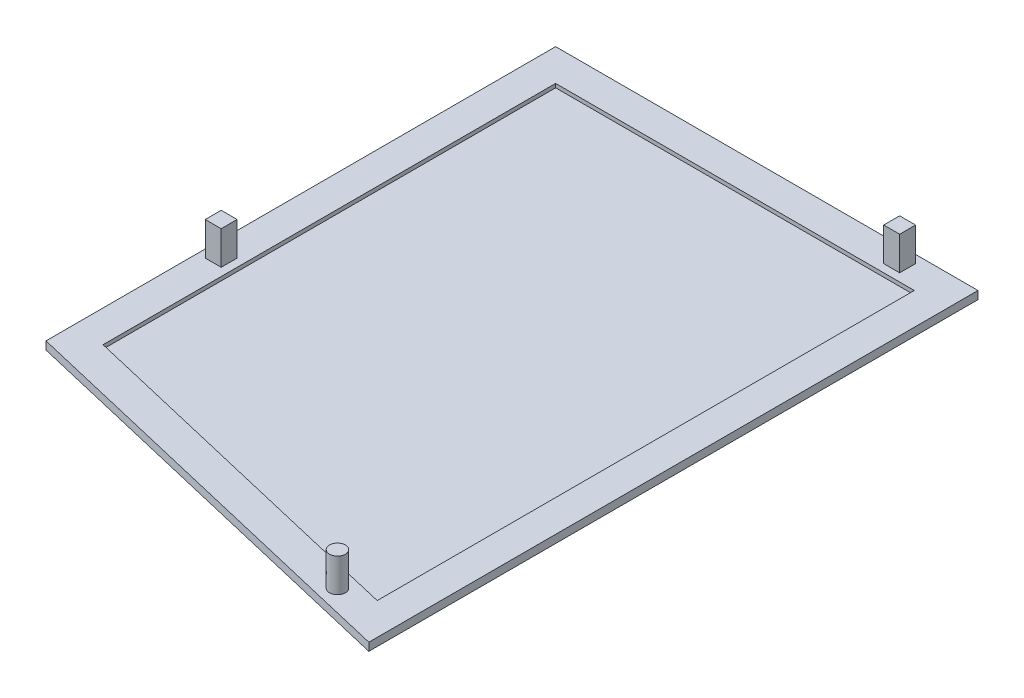
from build123d import *

# Parameters (mm, degrees)
BOSS_EXTRUDE1_DEPTH = 1.25
SKETCH2_R           = 1.25
SKETCH2_W           = 2.5
SKETCH2_H           = 2.5
BOSS_EXTRUDE2_DEPTH = 6.5
CUT_EXTRUDE1_DEPTH  = 0.6


with BuildPart() as part:
    # Sketch1 → Boss-Extrude1 (new body)
    with BuildSketch(Plane(origin=(0, 0, 0), x_dir=(1, 0, 0), z_dir=(0, 1, 0))):
        Polygon((0, 0), (0, 80), (66.3, 80), (66.3, -15.623791318), align=None)
    extrude(amount=BOSS_EXTRUDE1_DEPTH)

    # Sketch2 → Boss-Extrude2 (add)
    with BuildSketch(Plane.XZ):
        with Locations(Location((56.5, 10.745914737, 0), (0, 0, 270))):
            Circle(SKETCH2_R)
        with Locations((56.5, -77.5)):
            Rectangle(SKETCH2_W, SKETCH2_H)
        with Locations((2.5, -25)):
            Rectangle(SKETCH2_W, SKETCH2_H)
    extrude(amount=-BOSS_EXTRUDE2_DEPTH)

    # Sketch4 → Cut-Extrude1 (cut)
    with BuildSketch(Plane(origin=(0, 1.25, 0), x_dir=(1, 0, 0), z_dir=(0, 1, 0))):
        Polygon((5, 75), (5, 3.958690319), (61.3, -9.308571388), (61.3, 75), align=None)
    extrude(amount=-CUT_EXTRUDE1_DEPTH, mode=Mode.SUBTRACT)


solid = part.part
